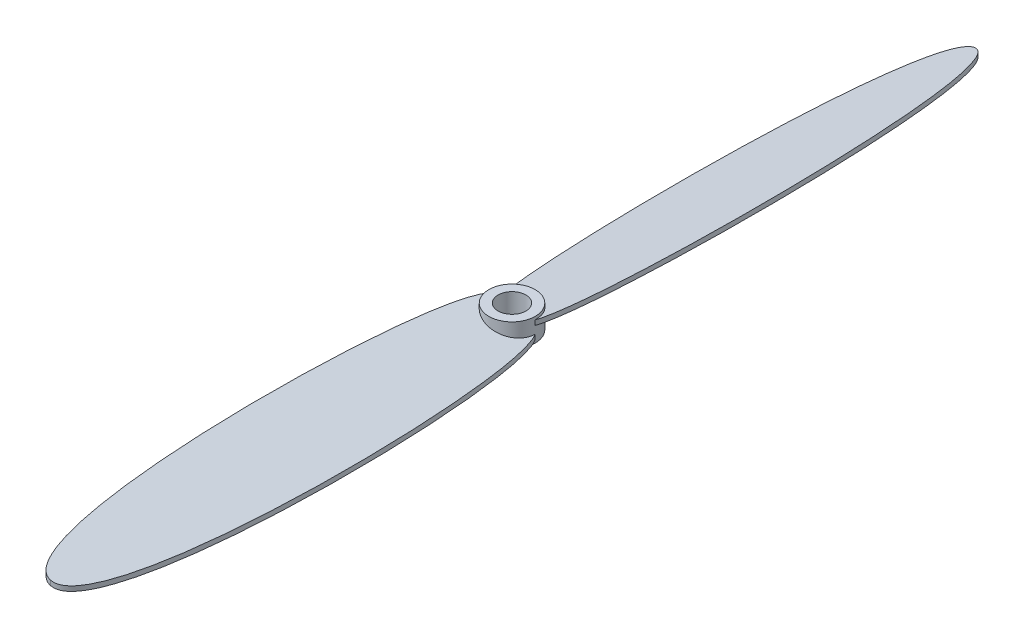
from build123d import *

# Parameters (mm, degrees)
SKETCH_1_R               = 5
SKETCH_1_R_2             = 3
EXTRUDE_1_DEPTH          = 5
EXTRUDE_7_DEPTH          = 100
EXTRUDE_8_DEPTH          = 100
SKETCH_8_R               = 3
CUT_EXTRUDE_1_DEPTH      = 101.669947854
CUT_EXTRUDE_2_DEPTH      = 101.669947854
CUT_EXTRUDE_2_DEPTH_BACK = 101.669947854
SKETCH_9_OUTSIDE_W       = 62.542
SKETCH_9_OUTSIDE_H       = 242.224


with BuildPart() as part:
    # 草圖1 → 填料-伸長1 (new body)
    with BuildSketch(Plane(origin=(0, 0, 0), x_dir=(1, 0, 0), z_dir=(0, 1, 0))):
        with Locations(Location((0, 0, 0), (0, 0, 270))):
            Circle(SKETCH_1_R)
        with Locations(Location((0, 0, 0), (0, 0, 270))):
            Circle(SKETCH_1_R_2, mode=Mode.SUBTRACT)
    extrude(amount=EXTRUDE_1_DEPTH)

    # 草圖6 → 填料-伸長7 (add)
    with BuildSketch(Plane.XY):
        with BuildLine():
            Line((9.52984874, -0.571153364), (-9.788667785, 4.605227538))
            ThreePointArc((-9.788667785, 4.605227538), (-10.142221176, 5.217599974), (-9.52984874, 5.571153364))
            Line((-9.52984874, 5.571153364), (9.788667785, 0.394772462))
            ThreePointArc((9.788667785, 0.394772462), (10.142221176, -0.217599974), (9.52984874, -0.571153364))
        make_face()
    extrude(amount=EXTRUDE_7_DEPTH)

    # 草圖7 → 填料-伸長8 (add)
    with BuildSketch(Plane.XY):
        with BuildLine():
            Line((-9.788667785, 0.394772462), (9.52984874, 5.571153364))
            ThreePointArc((9.52984874, 5.571153364), (10.142221176, 5.217599974), (9.788667785, 4.605227538))
            Line((9.788667785, 4.605227538), (-9.52984874, -0.571153364))
            ThreePointArc((-9.52984874, -0.571153364), (-10.142221176, -0.217599974), (-9.788667785, 0.394772462))
        make_face()
    extrude(amount=-EXTRUDE_8_DEPTH)

    # 草圖8 → 除料-伸長1 (cut, through all)
    with BuildSketch(Plane(origin=(0, 5, 0), x_dir=(1, 0, 0), z_dir=(0, 1, 0))):
        with Locations(Location((0, 0, 0), (0, 0, 270))):
            Circle(SKETCH_8_R)
    extrude(amount=-CUT_EXTRUDE_1_DEPTH, mode=Mode.SUBTRACT)

    # 草圖9 outside → 除料-伸長2 (cut, two sides: drawn at the far end of the back side and taken through both)
    with BuildSketch(Plane(origin=(0, 5, 0), x_dir=(1, 0, 0), z_dir=(0, 1, 0)).offset(-CUT_EXTRUDE_2_DEPTH_BACK)):
        Rectangle(SKETCH_9_OUTSIDE_W, SKETCH_9_OUTSIDE_H)
        with BuildLine():
            add(Edge.make_bspline(
                [(5, 0), (10.515647221, 9.319471188), (11.320981167, 99.5), (0, 99.5)],
                knots=[0, 0, 0, 0, 1, 1, 1, 1], degree=3))
            add(Edge.make_bspline(
                [(-5, 0), (-10.515647221, 9.319471188), (-11.320981167, 99.5), (0, 99.5)],
                knots=[0, 0, 0, 0, 1, 1, 1, 1], degree=3))
            add(Edge.make_bspline(
                [(-5, 0), (-10.515647221, -9.319471188), (-11.320981167, -99.5), (0, -99.5)],
                knots=[0, 0, 0, 0, 1, 1, 1, 1], degree=3))
            add(Edge.make_bspline(
                [(5, 0), (10.515647221, -9.319471188), (11.320981167, -99.5), (0, -99.5)],
                knots=[0, 0, 0, 0, 1, 1, 1, 1], degree=3))
        make_face(mode=Mode.SUBTRACT)
    extrude(amount=CUT_EXTRUDE_2_DEPTH + CUT_EXTRUDE_2_DEPTH_BACK, mode=Mode.SUBTRACT)


solid = part.part
